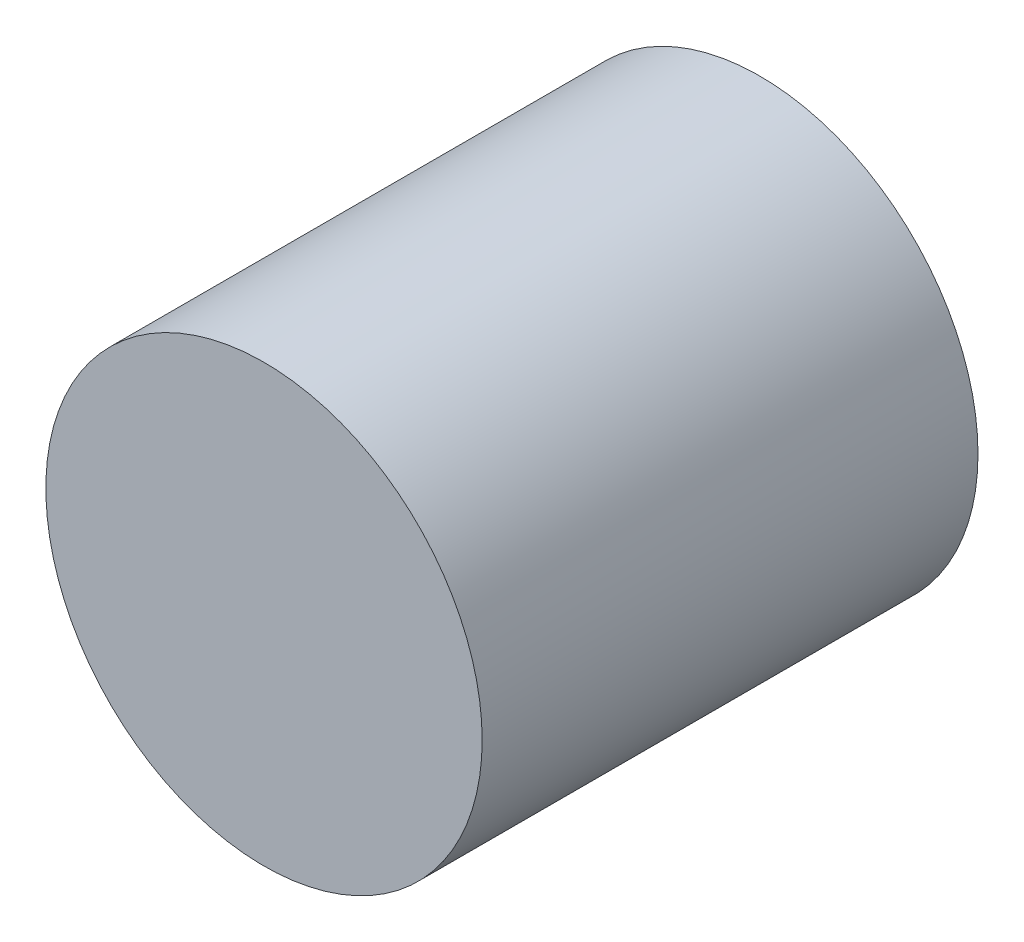
from build123d import *

# Parameters (mm, degrees)
SKETCH1_R           = 27.94
BOSS_EXTRUDE1_DEPTH = 63.5


with BuildPart() as part:
    # Sketch1 → Boss-Extrude1 (new body)
    with BuildSketch(Plane.XY):
        Circle(SKETCH1_R)
    extrude(amount=BOSS_EXTRUDE1_DEPTH)


solid = part.part
